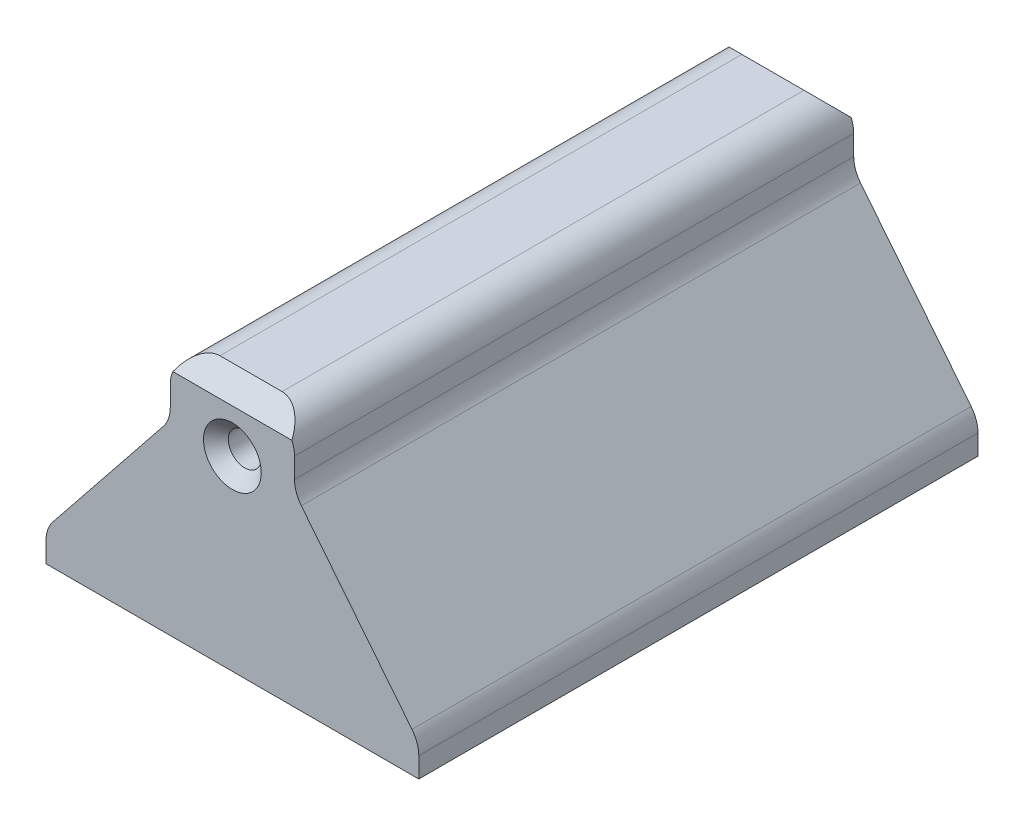
from build123d import *

# Parameters (mm, degrees)
SKETCH1_W           = 114.3
SKETCH1_H           = 50.8
BOSS_EXTRUDE1_DEPTH = 25.4
SKETCH2_R           = 3.3655
CUT_EXTRUDE1_DEPTH  = 128.633420388
CHAMFER1_SIZE       = 2.54
BOSS_EXTRUDE2_DEPTH = 114.3
CHAMFER2_SIZE       = 3.81
FILLET1_R           = 6.35


with BuildPart() as part:
    # Sketch1 → Boss-Extrude1 (new body)
    with BuildSketch(Plane(origin=(0, 0, 0), x_dir=(0, 0, -1), z_dir=(1, 0, 0))):
        with Locations((-57.15, -25.4)):
            Rectangle(SKETCH1_W, SKETCH1_H)
    extrude(amount=BOSS_EXTRUDE1_DEPTH)

    # Sketch2 → Cut-Extrude1 (cut, through all)
    with BuildSketch(Plane(origin=(0, 0, 0), x_dir=(-1, 0, 0), z_dir=(0, 0, -1))):
        with Locations(Location((-12.7, -12.7, 0), (0, 0, 90))):
            Circle(SKETCH2_R)
    extrude(amount=-CUT_EXTRUDE1_DEPTH, mode=Mode.SUBTRACT)

    # Chamfer1
    chamfer1_edges = [part.edges().sort_by_distance(p)[0] for p in [
        (12.7, -16.0655, 114.3),
        (12.7, -16.0655, 0),
    ]]
    chamfer(chamfer1_edges, length=CHAMFER1_SIZE)

    # Sketch3 → Boss-Extrude2 (add)
    with BuildSketch(Plane(origin=(0, 0, 0), x_dir=(-1, 0, 0), z_dir=(0, 0, -1))):
        Polygon((-50.8, -44.45), (-25.4, -12.7), (-25.4, -50.8), (-50.8, -50.8), align=None)
        Polygon((25.4, -50.8), (25.4, -44.45), (0, -12.7), (0, -50.8), align=None)
    extrude(amount=-BOSS_EXTRUDE2_DEPTH)

    # Chamfer2
    chamfer2_edges = [part.edges().sort_by_distance(p)[0] for p in [
        (12.7, 0, 114.3),
        (12.7, 0, 0),
    ]]
    chamfer(chamfer2_edges, length=CHAMFER2_SIZE)

    # Fillet1
    fillet1_edges = [part.edges().sort_by_distance(p)[0] for p in [
        (-25.4, -44.45, 57.15),
        (0, -12.7, 57.15),
        (0, 0, 57.15),
        (25.4, 0, 57.15),
        (50.8, -44.45, 57.15),
        (25.4, -12.7, 57.15),
    ]]
    fillet(fillet1_edges, radius=FILLET1_R)


solid = part.part
